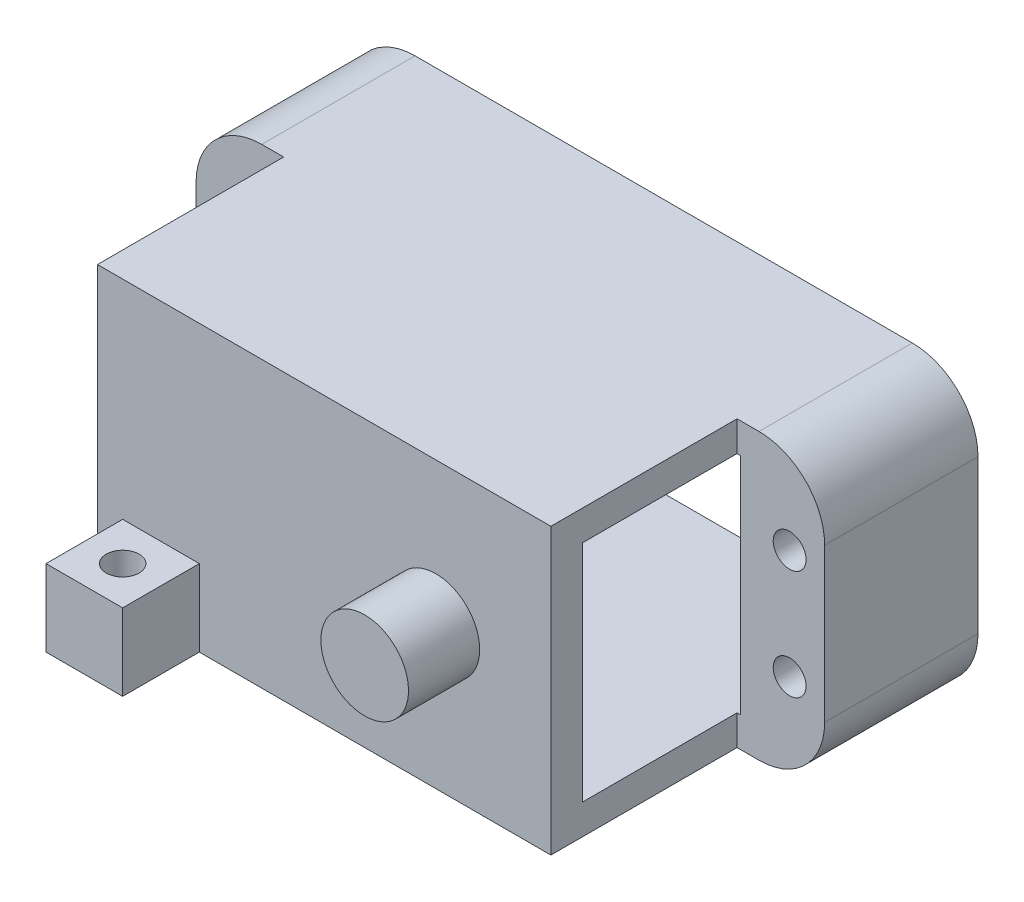
from build123d import *

# Parameters (mm, degrees)
SKETCH1_W                    = 49.7
SKETCH1_H                    = 26
BOSS_EXTRUDE1_DEPTH          = 14
SKETCH2_W                    = 41.4
SKETCH2_H                    = 26
BOSS_EXTRUDE2_DEPTH          = 17
CUT_EXTRUDE1_DEPTH           = 20.5
SKETCH4_W                    = 14
SKETCH4_H                    = 26
BOSS_EXTRUDE3_DEPTH          = 7.7
BOSS_EXTRUDE5_START          = -26
SKETCH6_W                    = 8
SKETCH6_H                    = 5
BOSS_EXTRUDE5_DEPTH          = 7
SKETCH5_W                    = 7
SKETCH5_H                    = 7
BOSS_EXTRUDE6_DEPTH          = 7
SKETCH7_W                    = 4
SKETCH7_H                    = 6.5
F_3_0_3_DIAMETER_HOLE1_D     = 3
F_3_0_3_DIAMETER_HOLE1_DEPTH = 38
F_3_0_3_DIAMETER_HOLE2_D     = 3
F_3_0_3_DIAMETER_HOLE2_DEPTH = 39.1
F_3_0_3_DIAMETER_HOLE3_D     = 3
F_3_0_3_DIAMETER_HOLE3_DEPTH = 33
FILLET1_R                    = 6


with BuildPart() as part:
    # Sketch1 → Boss-Extrude1 (new body)
    with BuildSketch(Plane(origin=(0, 0, 0), x_dir=(-1, 0, 0), z_dir=(0, 0, -1))):
        with Locations((3.85, 0)):
            Rectangle(SKETCH1_W, SKETCH1_H)
    extrude(amount=-BOSS_EXTRUDE1_DEPTH)

    # Sketch2 → Boss-Extrude2 (add)
    with BuildSketch(Plane.XY.offset(14)):
        Rectangle(SKETCH2_W, SKETCH2_H)
    extrude(amount=BOSS_EXTRUDE2_DEPTH)

    # Sketch3 → Cut-Extrude1 (cut)
    with BuildSketch(Plane(origin=(0, 10.25, 0), x_dir=(1, 0, 0), z_dir=(0, 1, 0))):
        Polygon((20.7, -14), (21, -14), (21, 0), (-21, 0), (-21, -14), (-20.7, -14), (-20.7, -28.1), (20.7, -28.1), align=None)
    extrude(amount=-CUT_EXTRUDE1_DEPTH, mode=Mode.SUBTRACT)

    # Sketch4 → Boss-Extrude3 (add)
    with BuildSketch(Plane(origin=(21, 0, 0), x_dir=(0, 0, -1), z_dir=(1, 0, 0))):
        with Locations((-7, 0)):
            Rectangle(SKETCH4_W, SKETCH4_H)
    extrude(amount=BOSS_EXTRUDE3_DEPTH)

    # Sketch6 → Boss-Extrude5 (add)
    with BuildSketch(Plane(origin=(0, 13, 0), x_dir=(-1, 0, 0), z_dir=(0, 1, 0)).offset(BOSS_EXTRUDE5_START)):
        with Locations((6.4, 2.5)):
            Rectangle(SKETCH6_W, SKETCH6_H)
    extrude(amount=-BOSS_EXTRUDE5_DEPTH)

    # Sketch5 → Boss-Extrude6 (add)
    with BuildSketch(Plane.XY.offset(31)):
        with Locations((-14.9, -9.5)):
            Rectangle(SKETCH5_W, SKETCH5_H)
    extrude(amount=BOSS_EXTRUDE6_DEPTH)

    # Sketch7 → Revolve1 (revolve)
    with BuildSketch(Plane.XZ, mode=Mode.PRIVATE) as revolve1_sk:
        with Locations((12.2, 34.25)):
            Rectangle(SKETCH7_W, SKETCH7_H)
    revolve(revolve1_sk.sketch.rotate(Axis((10.2, 0, 37.5), (0, 0, -1)), 180), axis=Axis((10.2, 0, 37.5), (0, 0, -1)))

    # Ø3.0 (3) Diameter Hole1
    with Locations(Plane(origin=(0, 0, 0), x_dir=(-1, 0, 0), z_dir=(0, 0, -1))):
        with Locations((-25.5, -5), (-25.5, 5), (25.5, -5), (25.5, 5)):
            Hole(F_3_0_3_DIAMETER_HOLE1_D / 2, depth=F_3_0_3_DIAMETER_HOLE1_DEPTH)

    # Ø3.0 (3) Diameter Hole2
    with Locations(Plane.ZY.offset(10.4)):
        with Locations((2.2, -16.5)):
            Hole(F_3_0_3_DIAMETER_HOLE2_D / 2, depth=F_3_0_3_DIAMETER_HOLE2_DEPTH)

    # Ø3.0 (3) Diameter Hole3
    with Locations(Plane(origin=(0, 13, 0), x_dir=(1, 0, 0), z_dir=(0, 1, 0))):
        with Locations((-14.9, -34.5)):
            Hole(F_3_0_3_DIAMETER_HOLE3_D / 2, depth=F_3_0_3_DIAMETER_HOLE3_DEPTH)

    # Fillet1
    fillet1_edges = [part.edges().sort_by_distance(p)[0] for p in [
        (28.7, -13, 7),
        (28.7, 13, 7),
        (-28.7, 13, 7),
        (-28.7, -13, 7),
    ]]
    fillet(fillet1_edges, radius=FILLET1_R)


solid = part.part
